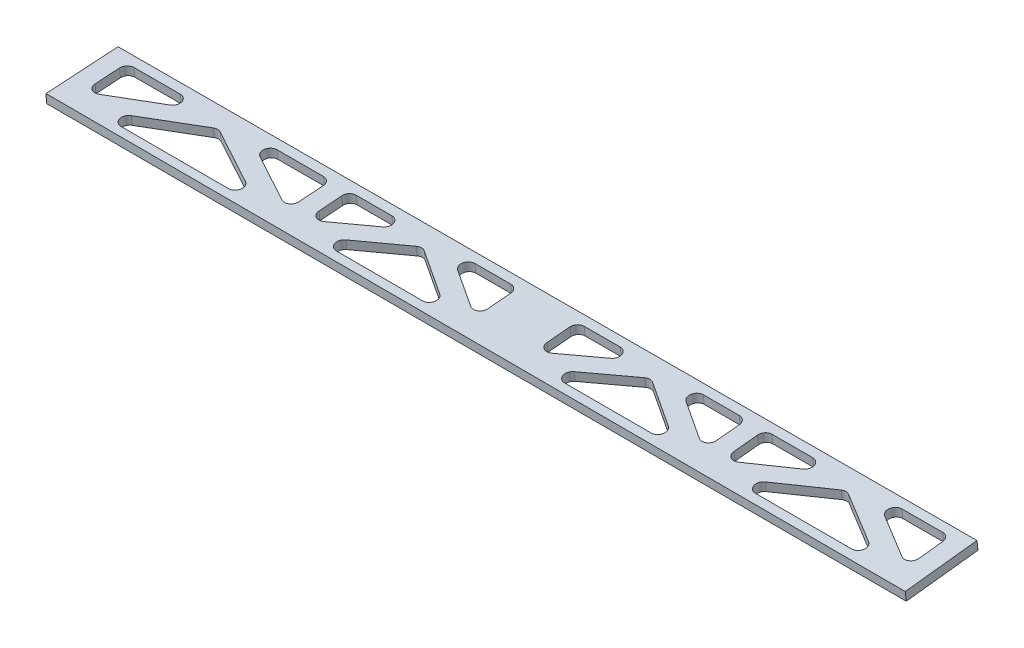
from build123d import *

# Parameters (mm, degrees)
CUT_EXTRUDE1_DEPTH      = 304.364365162
CUT_EXTRUDE1_DEPTH_BACK = 304.364365162
FILLET1_R               = 2.54


with BuildPart() as part:
    # Sketch1<7> → Loft6 section 0
    with BuildSketch(Plane(origin=(0, 0, 0), x_dir=(0, 0, -1), z_dir=(1, 0, 0))):
        with BuildLine():
            Line((17.276227552, -57.065250581), (16.90927633, -53.911527099))
            Line((16.90927633, -53.911527099), (42.139064186, -50.975917325))
            Line((42.139064186, -50.975917325), (42.506015408, -54.129640807))
            Line((42.506015408, -54.129640807), (17.276227552, -57.065250581))
        make_face()
    # Sketch2<7> → Loft6 section 1
    with BuildSketch(Plane(origin=(-301.244, 0, 0), x_dir=(0, 0, -1), z_dir=(1, 0, 0))):
        with BuildLine():
            Line((41.356959606, -53.811683647), (16.006708373, -55.400633756))
            Line((16.006708373, -55.400633756), (15.80808961, -52.231852352))
            Line((15.80808961, -52.231852352), (41.158340842, -50.642902243))
            Line((41.158340842, -50.642902243), (41.356959606, -53.811683647))
        make_face()
    loft()

    # Sketch3 → Cut-Extrude1 (cut, two sides: drawn at the far end of the back side and taken through both)
    with BuildSketch(Plane(origin=(-0.087388543, -58.286187953, -6.781884336), x_dir=(0.999998891063339, -0.0014792723179844819, -0.0001721206020672807), z_dir=(0.001489252192347282, 0.9932976329775466, 0.11557505980578586)).offset(-CUT_EXTRUDE1_DEPTH_BACK)):
        Polygon((-6.26261136, 32.766822272), (-6.26261136, 17.393228479), (-32.455584293, 32.670777444), align=None)
        Polygon((-131.099204967, 13.274784351), (-83.40258785, 13.443980496), (-107.250896408, 28.62662449), align=None)
        Polygon((-157.645271585, 32.211729825), (-181.421702548, 32.124546014), (-157.645271585, 16.94733015), align=None)
        Polygon((-211.045266858, 12.991188441), (-163.513545553, 13.159799645), (-187.279406206, 28.33026816), align=None)
        Polygon((-288.036648197, 12.71807379), (-230.034443055, 12.923827366), (-259.034933805, 28.243885147), align=None)
        Polygon((-223.282497269, 31.971050158), (-252.294417132, 31.86466877), (-223.282497269, 16.538573343), align=None)
        Polygon((-294.807195513, 31.708782209), (-294.808418661, 16.295541654), (-265.81842445, 31.815078715), align=None)
        Polygon((-216.932497269, 31.994334443), (-216.932497269, 16.749185885), (-193.177210862, 32.081440721), align=None)
        Polygon((-71.173287013, 32.528806731), (-71.173287013, 17.174368617), (-45.002296159, 32.624770953), align=None)
        Polygon((-77.523287013, 32.505522445), (-77.523287013, 17.228655051), (-101.382178139, 32.418036268), align=None)
        Polygon((-136.997476861, 32.287441501), (-136.997476861, 17.029824761), (-113.159754822, 32.374850055), align=None)
        Polygon((-64.890219535, 13.509650172), (-12.526251273, 13.695403001), (-38.708235404, 28.96654254), align=None)
    extrude(amount=CUT_EXTRUDE1_DEPTH + CUT_EXTRUDE1_DEPTH_BACK, mode=Mode.SUBTRACT)

    # Fillet1
    fillet1_edges = [part.edges().sort_by_distance(p)[0] for p in [
        (-230.117865805, -53.977277278, -19.291539059),
        (-223.366178328, -53.736783334, -22.902689179),
        (-163.59743207, -54.308528458, -19.567646022),
        (-157.729355388, -54.00670927, -23.345610863),
        (-83.487032059, -54.706905089, -19.90009717),
        (-77.607848982, -54.352382748, -23.669054523),
        (-6.347597868, -54.66922668, -23.871604589),
        (-12.611188138, -55.058860637, -20.194167648),
        (-64.97479249, -54.798878428, -19.976911434),
        (-71.257885412, -54.38765165, -23.618505557),
        (-137.081684318, -54.094921847, -23.438925988),
        (-131.183317244, -54.469790979, -19.702170155),
        (-211.128822059, -54.071879002, -19.370361959),
        (-288.119666063, -53.68810876, -19.050751193),
        (-217.016227357, -53.749839871, -23.116241805),
        (-294.891668992, -53.424682672, -22.621703437),
        (-38.793147177, -53.25779432, -35.35877064),
        (-107.335605983, -53.111522292, -34.999539872),
        (-187.363879631, -52.929075547, -34.679955606),
        (-259.119206729, -52.752256197, -34.572416012),
        (-294.891643164, -52.441880363, -38.024575164),
        (-252.378948773, -52.511326935, -38.189593859),
        (-217.017098556, -52.568949038, -38.326838934),
        (-181.50637358, -52.626682916, -38.464646594),
        (-137.082234868, -52.69872388, -38.637023371),
        (-101.467005652, -52.756331754, -38.775202152),
        (-71.258173326, -52.805091554, -38.892393367),
        (-32.540545761, -52.867446898, -39.042577234),
        (-6.347623539, -52.90954286, -39.144168097),
        (-45.087233299, -52.847257289, -38.993911201),
        (-77.608160978, -52.794849957, -38.867760335),
        (-113.244559371, -52.737296054, -38.729509687),
        (-157.729989206, -52.665265686, -38.556907883),
        (-193.261858827, -52.60758518, -38.419028377),
        (-223.367086064, -52.558611317, -38.302194717),
        (-265.902929403, -52.489255242, -38.137101097),
    ]]
    fillet(fillet1_edges, radius=FILLET1_R)


solid = part.part
